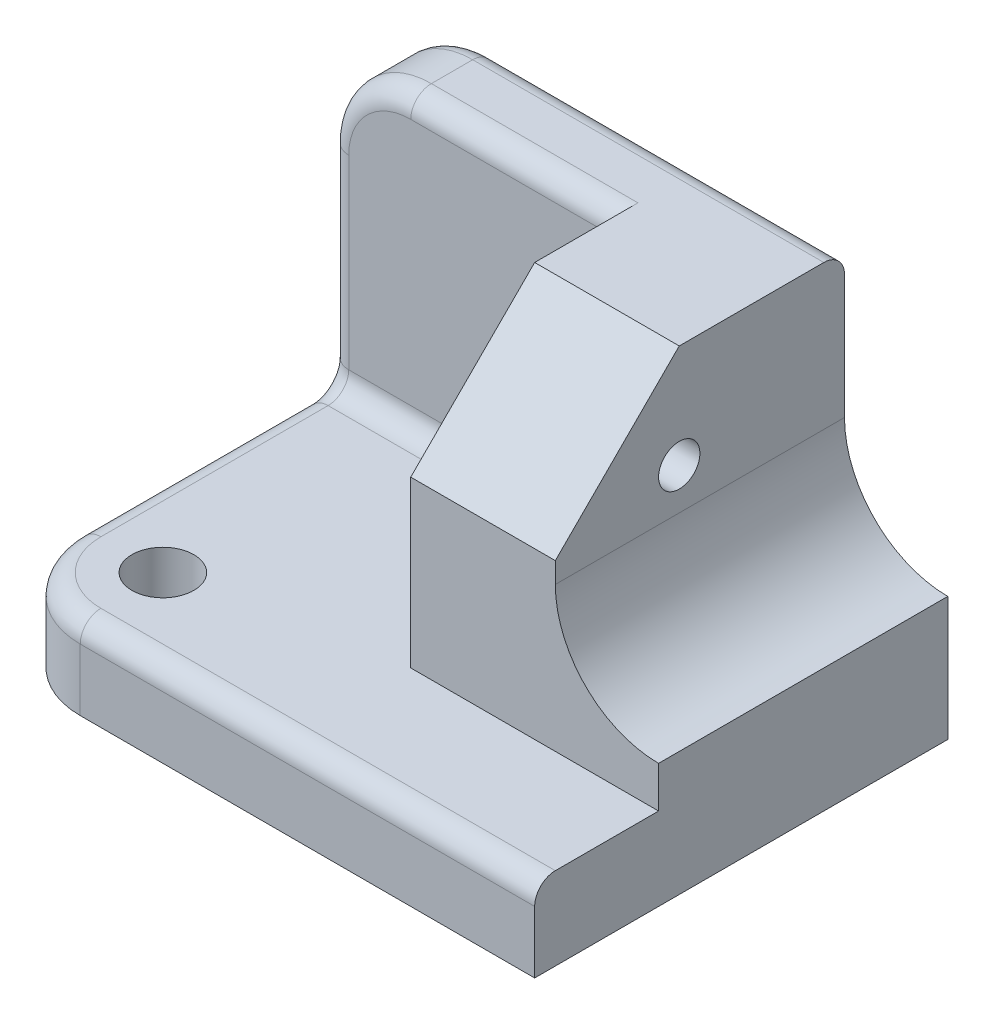
from build123d import *

# Parameters (mm, degrees)
SKETCH1_W                  = 130
SKETCH1_H                  = 100
BOSS_EXTRUDE1_DEPTH        = 20
SKETCH2_W                  = 130
SKETCH2_H                  = 20
BOSS_EXTRUDE2_DEPTH        = 70
FILLET1_R                  = 20
SKETCH3_W                  = 60
SKETCH3_H                  = 70
BOSS_EXTRUDE3_DEPTH        = 50
CUT_EXTRUDE1_DEPTH         = 132.244047484
CHAMFER1_SIZE              = 30
F_10_0_10_DIAMETER_HOLE1_D = 10
F_15_0_15_DIAMETER_HOLE1_D = 15
FILLET2_R                  = 5


with BuildPart() as part:
    # Sketch1 → Boss-Extrude1 (new body)
    with BuildSketch(Plane(origin=(0, 0, 0), x_dir=(1, 0, 0), z_dir=(0, 1, 0))):
        Rectangle(SKETCH1_W, SKETCH1_H)
    extrude(amount=BOSS_EXTRUDE1_DEPTH)

    # Sketch2 → Boss-Extrude2 (add)
    with BuildSketch(Plane(origin=(0, 20, 0), x_dir=(1, 0, 0), z_dir=(0, 1, 0))):
        with Locations((0, 40)):
            Rectangle(SKETCH2_W, SKETCH2_H)
    extrude(amount=BOSS_EXTRUDE2_DEPTH)

    # Fillet1
    fillet1_edges = [part.edges().sort_by_distance(p)[0] for p in [
        (-65, 10, 50),
        (-65, 90, -40),
    ]]
    fillet(fillet1_edges, radius=FILLET1_R)

    # Sketch3 → Boss-Extrude3 (add)
    with BuildSketch(Plane.XY.offset(-30)):
        with Locations((35, 55)):
            Rectangle(SKETCH3_W, SKETCH3_H)
    extrude(amount=BOSS_EXTRUDE3_DEPTH)

    # Sketch4 → Cut-Extrude1 (cut, through all)
    with BuildSketch(Plane.XY.offset(20)):
        with BuildLine():
            Line((40, 90), (40, 55))
            ThreePointArc((40, 55), (47.32233047, 37.32233047), (65, 30))
            Line((65, 30), (65, 90))
            Line((65, 90), (40, 90))
        make_face()
    extrude(amount=-CUT_EXTRUDE1_DEPTH, mode=Mode.SUBTRACT)

    # Chamfer1
    chamfer1_edges = [part.edges().sort_by_distance(p)[0] for p in [
        (22.5, 90, 20),
    ]]
    chamfer(chamfer1_edges, length=CHAMFER1_SIZE)

    # Ø10.0 (10) Diameter Hole1 (through all)
    with Locations(Plane.ZY.offset(-5)):
        with Locations((-10, 65)):
            Hole(F_10_0_10_DIAMETER_HOLE1_D / 2)

    # Ø15.0 (15) Diameter Hole1 (through all)
    with Locations(Plane(origin=(0, 20, 0), x_dir=(1, 0, 0), z_dir=(0, 1, 0))):
        with Locations((-45, -30)):
            Hole(F_15_0_15_DIAMETER_HOLE1_D / 2)

    # Fillet2
    fillet2_edges = [part.edges().sort_by_distance(p)[0] for p in [
        (-65, 20, 0),
        (10, 20, 50),
        (-65, 35, -50),
        (-2.5, 90, -50),
        (-20, 90, -30),
        (-65, 45, -30),
        (-59.142135624, 20, 44.142135624),
        (-59.142135624, 84.142135624, -50),
        (-59.142135624, 84.142135624, -30),
        (-30, 20, -30),
    ]]
    fillet(fillet2_edges, radius=FILLET2_R)


solid = part.part
